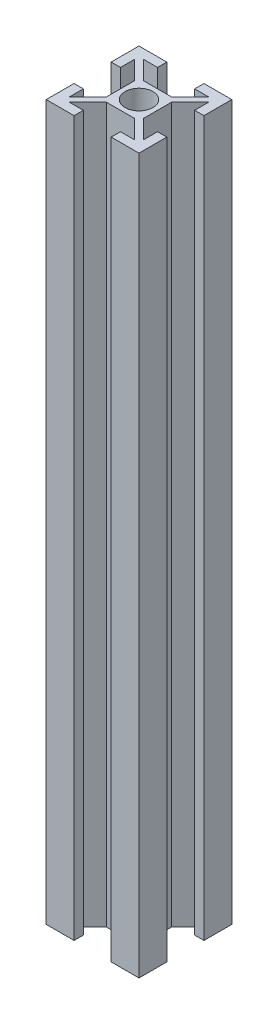
from build123d import *

# Parameters (mm, degrees)
F_2020_SKETCH_R     = 3
BOSS_EXTRUDE1_DEPTH = 154


with BuildPart() as part:
    # 2020 sketch → Boss-Extrude1 (new body)
    with BuildSketch(Plane(origin=(0, 0, 0), x_dir=(1, 0, 0), z_dir=(0, 1, 0))):
        Polygon((-4, 10), (-4, 8), (-7, 8), (-3, 4), (3, 4), (7, 8), (4, 8), (4, 10), (10, 10), (10, 4), (8, 4), (8, 7), (4, 3), (4, -3), (8, -7), (8, -4), (10, -4), (10, -10), (4, -10), (4, -8), (7, -8), (3, -4), (-3, -4), (-7, -8), (-4, -8), (-4, -10), (-10, -10), (-10, -4), (-8, -4), (-8, -7), (-4, -3), (-4, 3), (-8, 7), (-8, 4), (-10, 4), (-10, 10), align=None)
        with Locations(Location((0, 0, 0), (0, 0, 270))):
            Circle(F_2020_SKETCH_R, mode=Mode.SUBTRACT)
    extrude(amount=BOSS_EXTRUDE1_DEPTH)


solid = part.part
